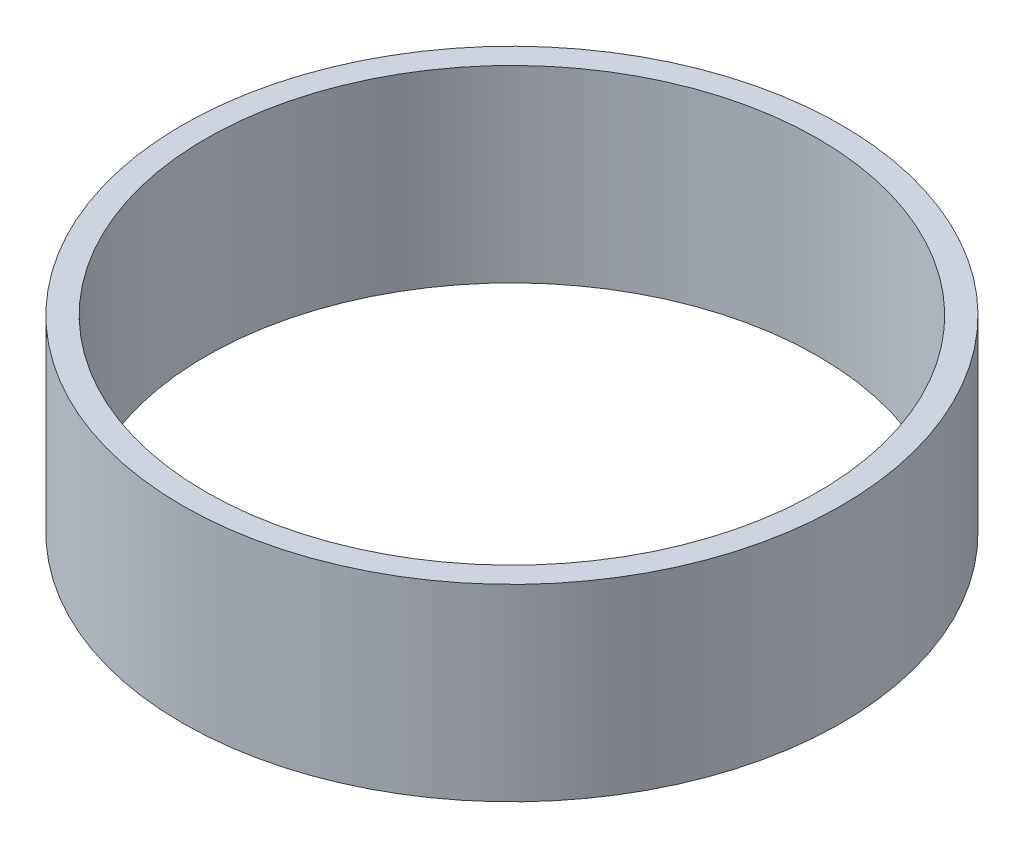
from build123d import *

# Parameters (mm, degrees)
SKETCH1_R           = 7
SKETCH1_R_2         = 6.5
BOSS_EXTRUDE1_DEPTH = 4


with BuildPart() as part:
    # Sketch1 → Boss-Extrude1 (new body)
    with BuildSketch(Plane(origin=(0, 0, 0), x_dir=(1, 0, 0), z_dir=(0, 1, 0))):
        with Locations(Location((0, 0, 0), (0, 0, 270))):
            Circle(SKETCH1_R)
        with Locations(Location((0, 0, 0), (0, 0, 270))):
            Circle(SKETCH1_R_2, mode=Mode.SUBTRACT)
    extrude(amount=BOSS_EXTRUDE1_DEPTH)


solid = part.part
